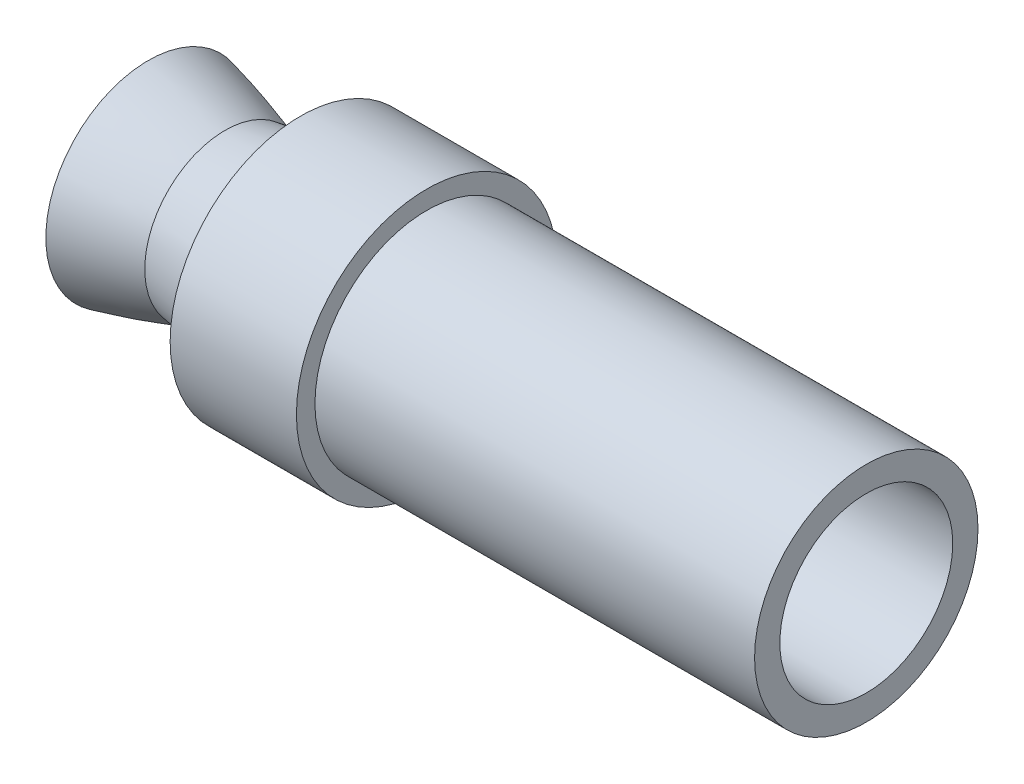
from build123d import *


with BuildPart() as part:
    # Sketch1 → Revolve1 (revolve)
    with BuildSketch(Plane.XY, mode=Mode.PRIVATE) as revolve1_sk:
        with BuildLine():
            Line((28.949236933, 27.386004017), (189.133015331, 27.386004017))
            Line((189.133015331, 27.386004017), (189.133015331, 35.386004017))
            Line((189.133015331, 35.386004017), (28.949236933, 35.386004017))
            ThreePointArc((28.949236933, 35.386004017), (22.060935151, 34.015835602), (16.221314872, 30.113926078))
            Line((16.221314872, 30.113926078), (7.884849119, 21.777460326))
            ThreePointArc((7.884849119, 21.777460326), (5.344435892, 20.007381854), (2.348184674, 19.226769399))
            add(Edge.make_bspline(
                [(2.348184674, 19.226769399), (0.313545637, 20.077506039), (-5.800272609, 22.518234313), (-11.933859149, 24.735791909), (-13.981586934, 25.437652311)],
                knots=[0.018493807, 0.018493807, 0.018493807, 0.117487589, 0.315475154, 0.414468937, 0.414468937, 0.414468937], degree=2))
            add(Edge.make_bspline(
                [(-13.981586934, 25.437652311), (-16.029314719, 26.139512712), (-28.160190772, 30.070121673), (-38.315022829, 32.432092239)],
                knots=[0.414468937, 0.414468937, 0.414468937, 0.513462719, 1, 1, 1], degree=2))
            Line((-38.315022829, 32.432092239), (-40.127010283, 24.64))
            add(Edge.make_bspline(
                [(0, 11.536137468), (-19.948257354, 19.947595697), (-40.127010283, 24.64)],
                knots=[0, 0, 0, 1, 1, 1], degree=2))
            ThreePointArc((0, 11.536137468), (0.81433228, 11.284876268), (1.662309445, 11.2))
            ThreePointArc((1.662309445, 11.2), (8.091391109, 12.478823854), (13.541703369, 16.120606076))
            Line((13.541703369, 16.120606076), (21.878169121, 24.457071829))
            ThreePointArc((21.878169121, 24.457071829), (25.12240261, 26.624799342), (28.949236933, 27.386004017))
        make_face()
        with BuildLine():
            Line((7.884849119, 21.777460326), (16.221314872, 30.113926078))
            Line((16.221314872, 30.113926078), (-13.981586934, 25.437652311))
            add(Edge.make_bspline(
                [(2.348184674, 19.226769399), (0.313545637, 20.077506039), (-5.800272609, 22.518234313), (-11.933859149, 24.735791909), (-13.981586934, 25.437652311)],
                knots=[0.018493807, 0.018493807, 0.018493807, 0.117487589, 0.315475154, 0.414468937, 0.414468937, 0.414468937], degree=2))
            ThreePointArc((2.348184674, 19.226769399), (5.344435892, 20.007381854), (7.884849119, 21.777460326))
        make_face()
    revolve(revolve1_sk.sketch.rotate(Axis((0, 0, 0), (-1, 0, 0)), 90), axis=Axis((0, 0, 0), (-1, 0, 0)))


with BuildPart() as body_2:
    # Sketch3 → Revolve2 (revolve)
    with BuildSketch(Plane.XY, mode=Mode.PRIVATE) as revolve2_sk:
        with BuildLine():
            Line((9.878169121, 29.131825541), (16.221314872, 30.113926078))
            ThreePointArc((16.221314872, 30.113926078), (22.060935151, 34.015835602), (28.949236933, 35.386004017))
            Line((28.949236933, 35.386004017), (49.878169121, 35.386004017))
            Line((49.878169121, 35.386004017), (49.878169121, 41.25))
            Line((49.878169121, 41.25), (9.878169121, 41.25))
            Line((9.878169121, 41.25), (9.878169121, 29.131825541))
        make_face()
    revolve(revolve2_sk.sketch.rotate(Axis((0, 0, 0), (-1, 0, 0)), 90), axis=Axis((0, 0, 0), (-1, 0, 0)))


solid = Compound([part.part, body_2.part])
